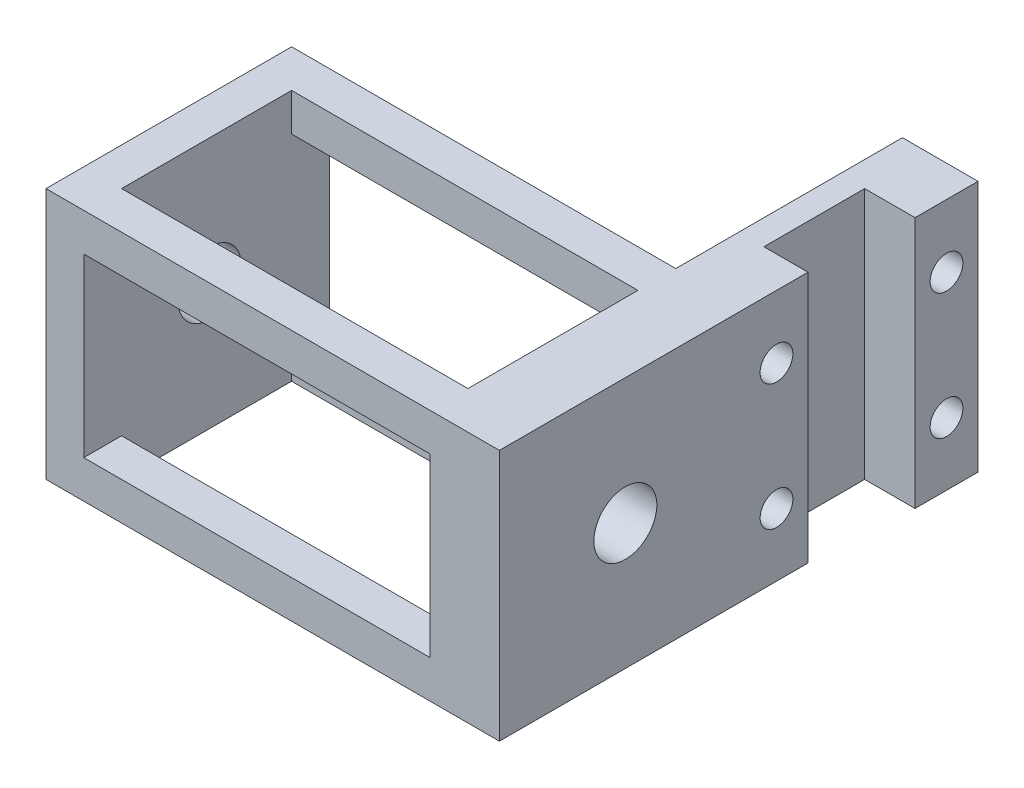
from build123d import *

# Parameters (mm, degrees)
BOSS_EXTRUDE1_DEPTH = 20
SKETCH4_W           = 30.5
SKETCH4_H           = 19.5
BOSS_EXTRUDE2_DEPTH = 20
CUT_EXTRUDE1_REACH  = 51.015
SKETCH6_W           = 27.5
SKETCH6_H           = 13.5
SKETCH7_W           = 27.5
SKETCH7_H           = 14
CUT_EXTRUDE2_DEPTH  = 58.610327885
SKETCH9_R           = 2.5
CUT_EXTRUDE3_DEPTH  = 48.138494794
CUT_EXTRUDE4_REACH  = 49.138
SKETCH10_R          = 1.3
CUT_EXTRUDE5_REACH  = 48.752
SKETCH11_R          = 1.3


with BuildPart() as part:
    # Sketch1 → Boss-Extrude1 (new body)
    with BuildSketch(Plane(origin=(0, 0, 0), x_dir=(-1, 0, 0), z_dir=(0, 1, 0))):
        Polygon((2.893442623, -2.368852459), (2.893442623, 22.131147541), (8.393442623, 22.131147541), (8.393442623, -15.368852459), (2.393442623, -15.368852459), (2.393442623, -10.368852459), (6.393442623, -10.368852459), (6.393442623, -2.368852459), align=None)
    extrude(amount=BOSS_EXTRUDE1_DEPTH)

    # Sketch4 → Boss-Extrude2 (add)
    with BuildSketch(Plane(origin=(0, 20, 0), x_dir=(-1, 0, 0), z_dir=(0, 1, 0))):
        with Locations((23.643442623, 12.381147541)):
            Rectangle(SKETCH4_W, SKETCH4_H)
    extrude(amount=-BOSS_EXTRUDE2_DEPTH)

    # Sketch6 → Cut-Extrude1 (cut, up to next)
    with BuildSketch(Plane(origin=(0, 20, 0), x_dir=(-1, 0, 0), z_dir=(0, 1, 0)), mode=Mode.PRIVATE) as cut_extrude1_sk1:
        with Locations((22.143442623, 12.381147541)):
            Rectangle(SKETCH6_W, SKETCH6_H)
    cut_extrude1_tool1 = extrude(cut_extrude1_sk1.sketch, amount=-CUT_EXTRUDE1_REACH, mode=Mode.PRIVATE) & part.part
    add(cut_extrude1_tool1.solids().sort_by_distance((-22.143443, 20, 12.381148))[0], mode=Mode.SUBTRACT)

    # Sketch7 → Cut-Extrude2 (cut, through all)
    with BuildSketch(Plane.XY.offset(22.131147541)):
        with Locations((-22.143442623, 10)):
            Rectangle(SKETCH7_W, SKETCH7_H)
    extrude(amount=-CUT_EXTRUDE2_DEPTH, mode=Mode.SUBTRACT)

    # Sketch9 → Cut-Extrude3 (cut, through all)
    with BuildSketch(Plane(origin=(-38.893442623, 0, 0), x_dir=(0, -1, 0), z_dir=(-1, 0, 0))):
        with Locations(Location((-10, 12.131147541, 0), (0, 0, 90))):
            Circle(SKETCH9_R)
    extrude(amount=-CUT_EXTRUDE3_DEPTH, mode=Mode.SUBTRACT)

    # Sketch10 → Cut-Extrude4 (cut, up to next)
    with BuildSketch(Plane.YZ.offset(-2.393442623), mode=Mode.PRIVATE) as cut_extrude4_sk1:
        with Locations(Location((5, -12.868852459, 0), (0, 0, 270))):
            Circle(SKETCH10_R)
    cut_extrude4_tool1 = extrude(cut_extrude4_sk1.sketch, amount=-CUT_EXTRUDE4_REACH, mode=Mode.PRIVATE) & part.part
    # Sketch10 → Cut-Extrude4 (cut, up to next)
    with BuildSketch(Plane.YZ.offset(-2.393442623), mode=Mode.PRIVATE) as cut_extrude4_sk2:
        with Locations(Location((15, -12.868852459, 0), (0, 0, 270))):
            Circle(SKETCH10_R)
    cut_extrude4_tool2 = extrude(cut_extrude4_sk2.sketch, amount=-CUT_EXTRUDE4_REACH, mode=Mode.PRIVATE) & part.part
    add(cut_extrude4_tool1.solids().sort_by_distance((-2.393443, 5, -12.868852))[0], mode=Mode.SUBTRACT)
    add(cut_extrude4_tool2.solids().sort_by_distance((-2.393443, 15, -12.868852))[0], mode=Mode.SUBTRACT)

    # Sketch11 → Cut-Extrude5 (cut, up to next)
    with BuildSketch(Plane.YZ.offset(-2.893442623), mode=Mode.PRIVATE) as cut_extrude5_sk1:
        with Locations(Location((5, 0.131147541, 0), (0, 0, 270))):
            Circle(SKETCH11_R)
    cut_extrude5_tool1 = extrude(cut_extrude5_sk1.sketch, amount=-CUT_EXTRUDE5_REACH, mode=Mode.PRIVATE) & part.part
    # Sketch11 → Cut-Extrude5 (cut, up to next)
    with BuildSketch(Plane.YZ.offset(-2.893442623), mode=Mode.PRIVATE) as cut_extrude5_sk2:
        with Locations(Location((15, 0.131147541, 0), (0, 0, 270))):
            Circle(SKETCH11_R)
    cut_extrude5_tool2 = extrude(cut_extrude5_sk2.sketch, amount=-CUT_EXTRUDE5_REACH, mode=Mode.PRIVATE) & part.part
    add(cut_extrude5_tool1.solids().sort_by_distance((-2.893443, 5, 0.131148))[0], mode=Mode.SUBTRACT)
    add(cut_extrude5_tool2.solids().sort_by_distance((-2.893443, 15, 0.131148))[0], mode=Mode.SUBTRACT)


solid = part.part
